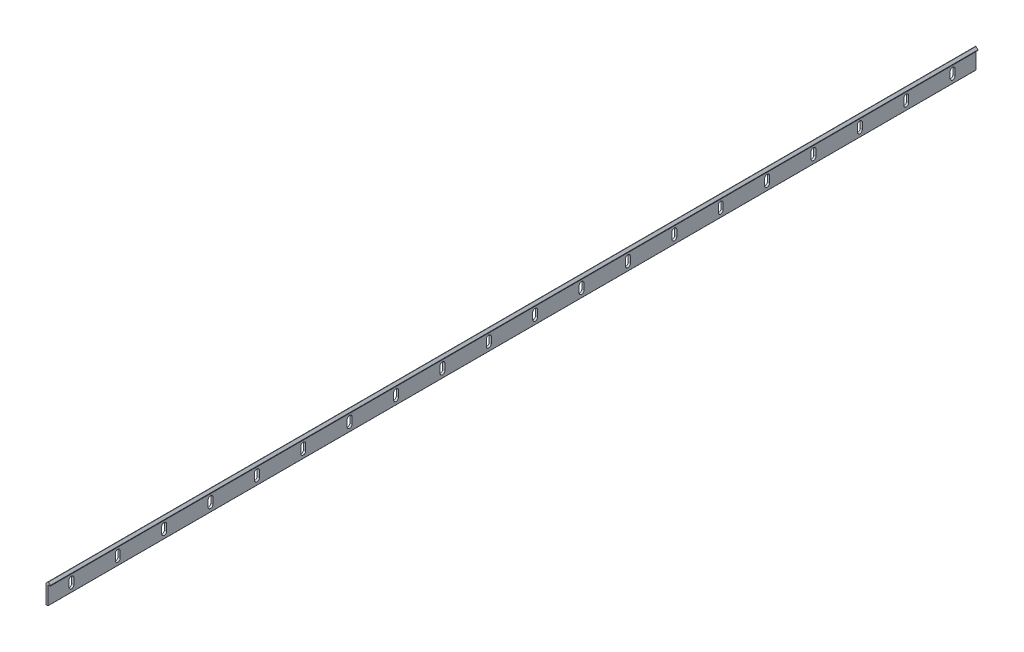
from build123d import *

# Parameters (mm, degrees)
BOSS_EXTRUDE1_DEPTH = 1000
CUT_EXTRUDE1_DEPTH  = 1001.255912567
LPATTERN1_COUNT     = 20
LPATTERN1_PITCH     = 50


with BuildPart() as part:
    # Sketch1 → Boss-Extrude1 (new body)
    with BuildSketch(Plane.XY):
        with BuildLine():
            Line((0, 0.3), (0, 20.125))
            ThreePointArc((0, 20.125), (0.02283614, 20.23980503), (0.087867966, 20.337132034))
            Line((0.087867966, 20.337132034), (2.162867966, 22.412132034))
            ThreePointArc((2.162867966, 22.412132034), (2.375, 22.5), (2.587132034, 22.412132034))
            Line((2.587132034, 22.412132034), (4.662132034, 20.337132034))
            ThreePointArc((4.662132034, 20.337132034), (4.72716386, 20.23980503), (4.75, 20.125))
            Line((4.75, 20.125), (4.75, 19.85))
            ThreePointArc((4.75, 19.85), (4.662132034, 19.637867966), (4.45, 19.55))
            Line((4.45, 19.55), (2.375, 19.55))
            Line((2.375, 19.55), (2.375, 0.3))
            ThreePointArc((2.375, 0.3), (2.287132034, 0.087867966), (2.075, 0))
            Line((2.075, 0), (0.3, 0))
            ThreePointArc((0.3, 0), (0.087867966, 0.087867966), (0, 0.3))
        make_face()
    extrude(amount=BOSS_EXTRUDE1_DEPTH)

    # Sketch2 → Cut-Extrude1 (cut, through all)
    with BuildSketch(Plane(origin=(2.375, 0, 0), x_dir=(0, 0, -1), z_dir=(1, 0, 0))):
        with BuildLine():
            Line((-22.35, 12.7), (-22.35, 6))
            ThreePointArc((-22.35, 6), (-25, 3.35), (-27.65, 6))
            Line((-27.65, 6), (-27.65, 12.7))
            ThreePointArc((-27.65, 12.7), (-25, 15.35), (-22.35, 12.7))
        make_face()
    cut_extrude1 = extrude(amount=-CUT_EXTRUDE1_DEPTH, mode=Mode.SUBTRACT)

    # LPattern1: Cut-Extrude1 ×20
    with Locations(*[(0, 0, i * LPATTERN1_PITCH) for i in range(1, LPATTERN1_COUNT)]):
        add(cut_extrude1, mode=Mode.SUBTRACT)


solid = part.part
